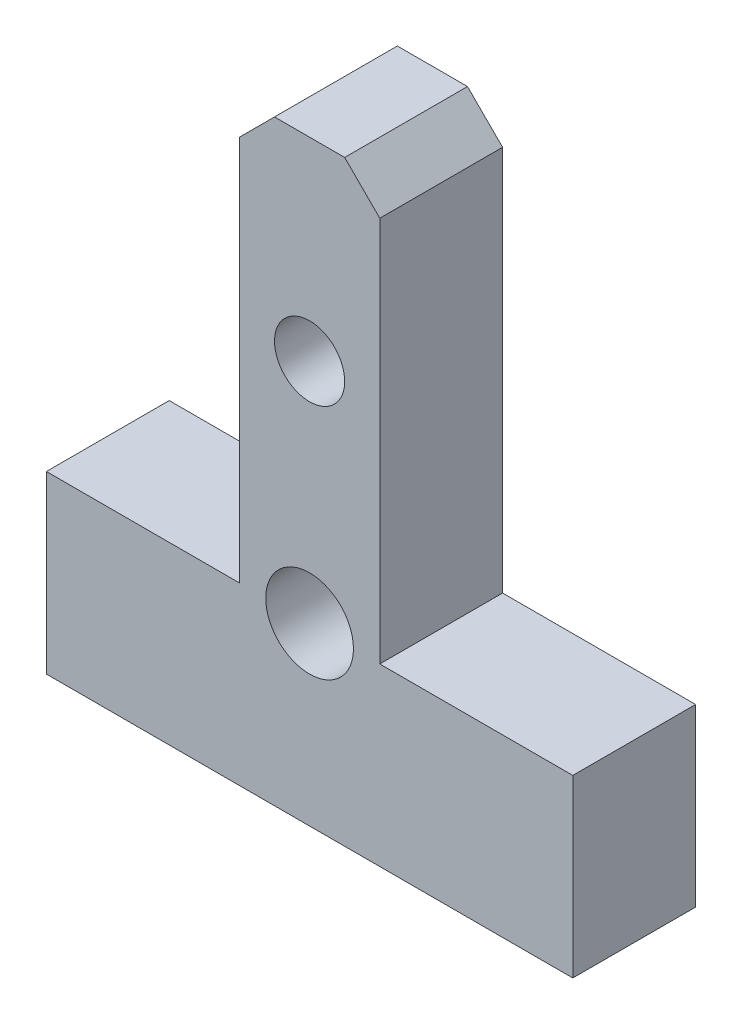
from build123d import *

# Parameters (mm, degrees)
EXTRUDE_1_DEPTH     = 7
SKETCH_3_W          = 8
SKETCH_3_H          = 7
EXTRUDE_3_DEPTH     = 13.5
SKETCH_2_R          = 2.5
SKETCH_2_R_2        = 1.999999991
CUT_EXTRUDE_2_DEPTH = 29.218856731
CHAMFER_1_SIZE      = 2


with BuildPart() as part:
    # Эскиз1 → Вытянуть1 (new body)
    with BuildSketch(Plane.XY):
        Polygon((-15, -1.146031522), (-15, -11.146031522), (15, -11.146031522), (15, -1.146031522), (4, -1.146031522), (4, 9.353968478), (-4, 9.353968478), (-4, -1.146031522), align=None)
    extrude(amount=EXTRUDE_1_DEPTH)

    # Эскиз3 → Вытянуть3 (add)
    with BuildSketch(Plane(origin=(0, 9.353968478, 0), x_dir=(1, 0, 0), z_dir=(0, 1, 0))):
        with Locations((0, -3.5)):
            Rectangle(SKETCH_3_W, SKETCH_3_H)
    extrude(amount=EXTRUDE_3_DEPTH)

    # Эскиз2 → Вытянуть2 (cut, through all)
    with BuildSketch(Plane.XY.offset(7)):
        with Locations((0, -1.14603177)):
            Circle(SKETCH_2_R)
        with Locations((4.2e-08, 11.794624395)):
            Circle(SKETCH_2_R_2)
    extrude(amount=-CUT_EXTRUDE_2_DEPTH, mode=Mode.SUBTRACT)

    # Фаска1
    chamfer_1_edges = [part.edges().sort_by_distance(p)[0] for p in [
        (4, 22.853968478, 3.5),
        (-4, 22.853968478, 3.5),
    ]]
    chamfer(chamfer_1_edges, length=CHAMFER_1_SIZE)


solid = part.part
